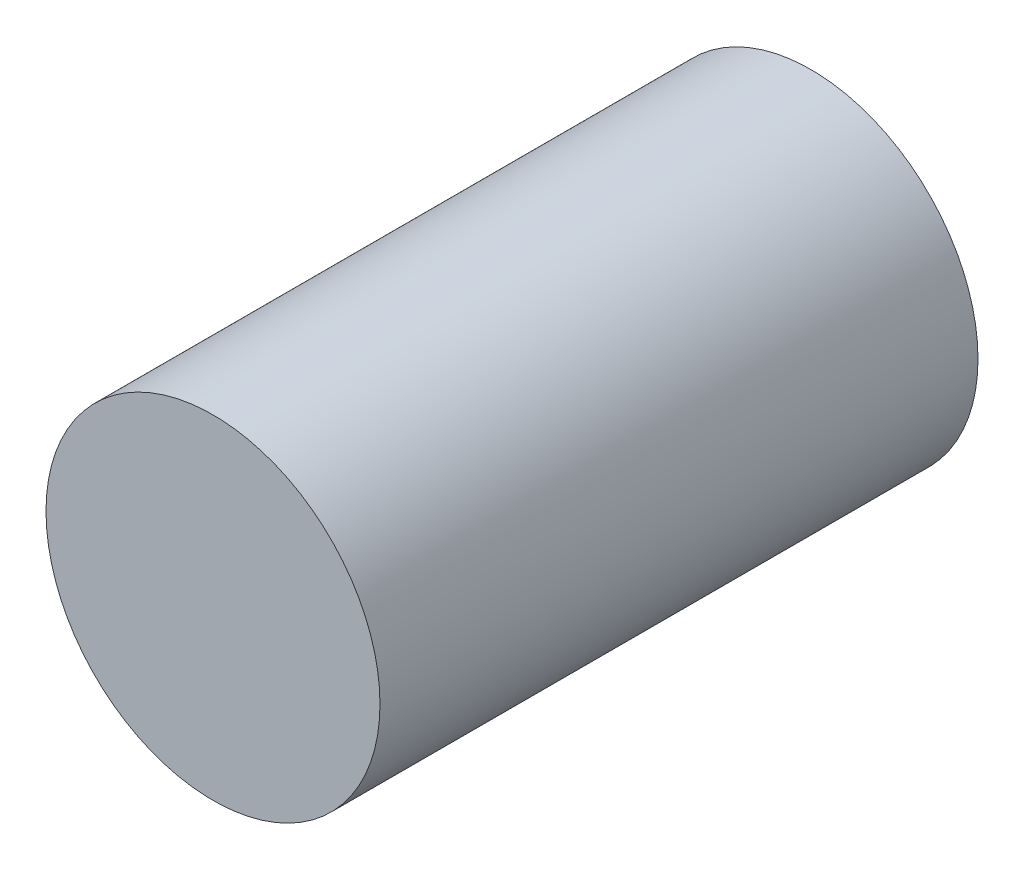
from build123d import *

# Parameters (mm, degrees)
SKETCH2_R           = 32.004
BOSS_EXTRUDE1_DEPTH = 114.6048


with BuildPart() as part:
    # Sketch2 → Boss-Extrude1 (new body)
    with BuildSketch(Plane.XY):
        Circle(SKETCH2_R)
    extrude(amount=BOSS_EXTRUDE1_DEPTH)


solid = part.part
